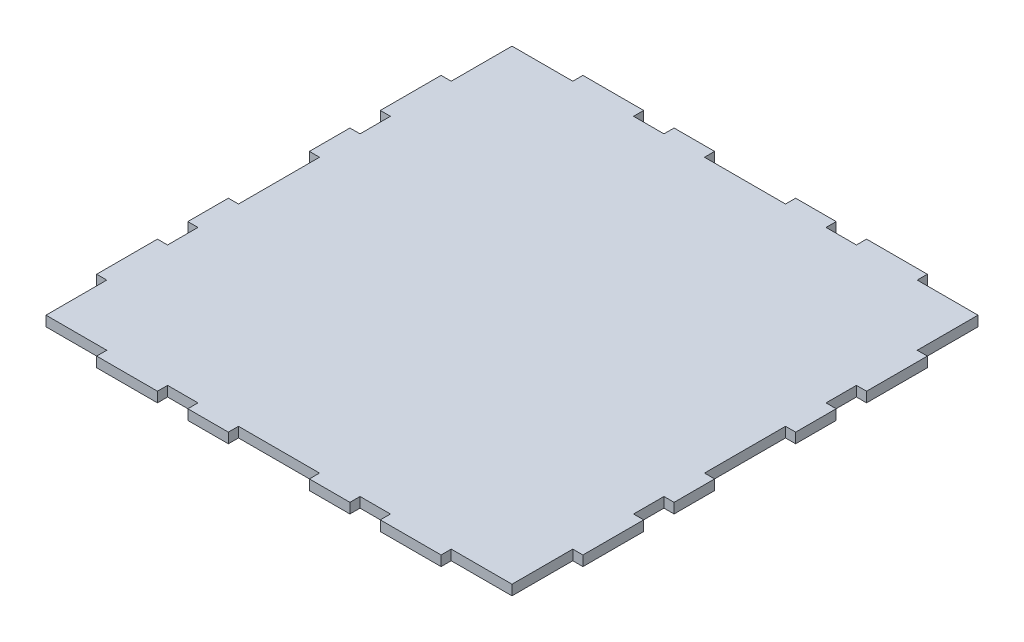
from build123d import *

# Parameters (mm, degrees)
SKETCH2_W           = 38.1
SKETCH2_H           = 6.35
SKETCH2_W_2         = 25.4
SKETCH2_W_3         = 6.35
SKETCH2_H_2         = 38.1
SKETCH2_H_3         = 25.4
BOSS_EXTRUDE1_DEPTH = 6.35


with BuildPart() as part:
    # Sketch2 → Boss-Extrude1 (new body)
    with BuildSketch(Plane(origin=(0, 0, 0), x_dir=(1, 0, 0), z_dir=(0, 1, 0))):
        with Locations((57.15, -3.175)):
            Rectangle(SKETCH2_W, SKETCH2_H)
        with Locations((107.95, -3.175)):
            Rectangle(SKETCH2_W_2, SKETCH2_H)
        with Locations((184.15, -3.175)):
            Rectangle(SKETCH2_W_2, SKETCH2_H)
        with Locations((234.95, -3.175)):
            Rectangle(SKETCH2_W, SKETCH2_H)
        with Locations((295.275, 57.15)):
            Rectangle(SKETCH2_W_3, SKETCH2_H_2)
        with Locations((295.275, 107.95)):
            Rectangle(SKETCH2_W_3, SKETCH2_H_3)
        with Locations((295.275, 184.15)):
            Rectangle(SKETCH2_W_3, SKETCH2_H_3)
        with Locations((295.275, 234.95)):
            Rectangle(SKETCH2_W_3, SKETCH2_H_2)
        with Locations((234.95, 295.275)):
            Rectangle(SKETCH2_W, SKETCH2_H)
        with Locations((184.15, 295.275)):
            Rectangle(SKETCH2_W_2, SKETCH2_H)
        with Locations((107.95, 295.275)):
            Rectangle(SKETCH2_W_2, SKETCH2_H)
        with Locations((57.15, 295.275)):
            Rectangle(SKETCH2_W, SKETCH2_H)
        with Locations((-3.175, 234.95)):
            Rectangle(SKETCH2_W_3, SKETCH2_H_2)
        with Locations((-3.175, 184.15)):
            Rectangle(SKETCH2_W_3, SKETCH2_H_3)
        with Locations((-3.175, 107.95)):
            Rectangle(SKETCH2_W_3, SKETCH2_H_3)
        with Locations((-3.175, 57.15)):
            Rectangle(SKETCH2_W_3, SKETCH2_H_2)
        Polygon((0, 0), (146.05, 146.05), (0, 146.05), (0, 120.65), (0, 95.25), (0, 76.2), (0, 38.1), align=None)
        Polygon((120.65, 0), (146.05, 0), (146.05, 146.05), (0, 0), (38.1, 0), (76.2, 0), (95.25, 0), align=None)
        Polygon((146.05, 146.05), (146.05, 0), (171.45, 0), (196.85, 0), (215.9, 0), (254, 0), (292.1, 0), (292.1, 38.1), (292.1, 76.2), (292.1, 95.25), (292.1, 120.65), (292.1, 146.05), align=None)
        Polygon((292.1, 292.1), (146.05, 146.05), (292.1, 146.05), (292.1, 171.45), (292.1, 196.85), (292.1, 215.9), (292.1, 254), align=None)
        Polygon((146.05, 292.1), (146.05, 146.05), (292.1, 292.1), (254, 292.1), (215.9, 292.1), (196.85, 292.1), (171.45, 292.1), align=None)
        Polygon((0, 146.05), (146.05, 146.05), (146.05, 292.1), (120.65, 292.1), (95.25, 292.1), (76.2, 292.1), (38.1, 292.1), (0, 292.1), (0, 254), (0, 215.9), (0, 196.85), (0, 171.45), align=None)
    extrude(amount=BOSS_EXTRUDE1_DEPTH)


solid = part.part
